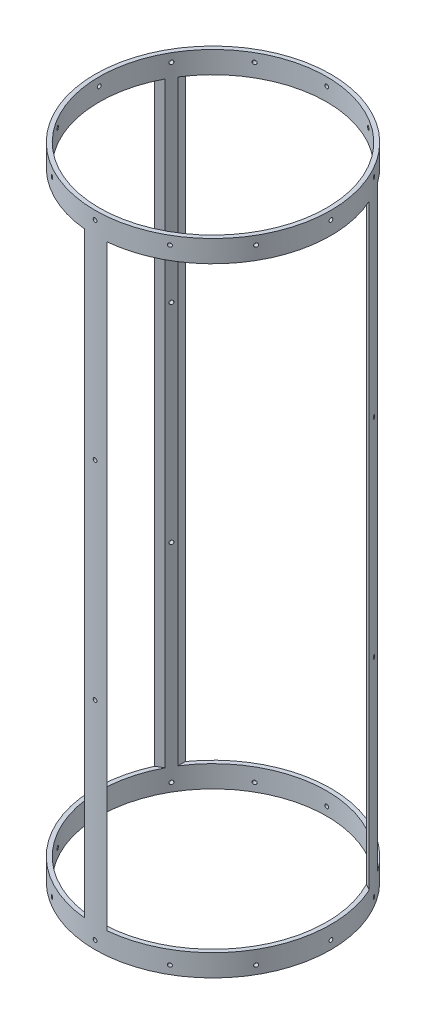
from build123d import *

# Parameters (mm, degrees)
SKETCH1_R                = 88.9
SKETCH1_R_2              = 85.725
BOSS_EXTRUDE1_DEPTH      = 241.427
CUT_EXTRUDE1_REACH       = 274.201
CUT_EXTRUDE1_END_RADIUS  = 88.9
SKETCH2_W                = 144.78
SKETCH2_H                = 449.834
CIRPATTERN1_COUNT        = 3
SKETCH4_R                = 1.4351
CUT_EXTRUDE3_DEPTH       = 15.24
CIRPATTERN3_COUNT        = 12
MIRROR1_COPY_1_SKETCH_R  = 1.4351
MIRROR1_COPY_1_DEPTH     = 15.24
MIRROR1_COPY_2_SKETCH_R  = 1.4351
MIRROR1_COPY_2_DEPTH     = 15.24
MIRROR1_COPY_3_SKETCH_R  = 1.4351
MIRROR1_COPY_3_DEPTH     = 15.24
MIRROR1_COPY_4_SKETCH_R  = 1.4351
MIRROR1_COPY_4_DEPTH     = 15.24
MIRROR1_COPY_5_SKETCH_R  = 1.4351
MIRROR1_COPY_5_DEPTH     = 15.24
MIRROR1_COPY_6_SKETCH_R  = 1.4351
MIRROR1_COPY_6_DEPTH     = 15.24
MIRROR1_COPY_7_SKETCH_R  = 1.4351
MIRROR1_COPY_7_DEPTH     = 15.24
MIRROR1_COPY_8_SKETCH_R  = 1.4351
MIRROR1_COPY_8_DEPTH     = 15.24
MIRROR1_COPY_9_SKETCH_R  = 1.4351
MIRROR1_COPY_9_DEPTH     = 15.24
MIRROR1_COPY_10_SKETCH_R = 1.4351
MIRROR1_COPY_10_DEPTH    = 15.24
MIRROR1_COPY_11_SKETCH_R = 1.4351
MIRROR1_COPY_11_DEPTH    = 15.24
SKETCH5_R                = 1.4351
CUT_EXTRUDE4_DEPTH       = 22.86
CIRPATTERN4_COUNT        = 3


with BuildPart() as part:
    # Sketch1 → Boss-Extrude1 (new, symmetric)
    with BuildSketch(Plane(origin=(0, 0, 0), x_dir=(1, 0, 0), z_dir=(0, 1, 0))):
        with Locations(Location((0, 0, 0), (0, 0, 270))):
            Circle(SKETCH1_R)
        with Locations(Location((0, 0, 0), (0, 0, 270))):
            Circle(SKETCH1_R_2, mode=Mode.SUBTRACT)
    extrude(amount=BOSS_EXTRUDE1_DEPTH, both=True)

    # Cut-Extrude1: up to this cylinder (the profile starts inside it)
    cut_extrude1_end = Plane(origin=(0, 0, 0), z_dir=(0, -1, 0)) * Cylinder(CUT_EXTRUDE1_END_RADIUS, 727.202, mode=Mode.PRIVATE)
    # Sketch2 → Cut-Extrude1 (cut, up to the surface)
    with BuildSketch(Plane.XY, mode=Mode.PRIVATE) as cut_extrude1_sk1:
        Rectangle(SKETCH2_W, SKETCH2_H)
    cut_extrude1_tool1 = extrude(cut_extrude1_sk1.sketch, amount=-CUT_EXTRUDE1_REACH, mode=Mode.PRIVATE) & cut_extrude1_end
    cut_extrude1 = cut_extrude1_tool1.solids().sort_by_distance((0, 0, 0))[0]
    add(cut_extrude1, mode=Mode.SUBTRACT)

    # CirPattern1: Cut-Extrude1 ×3 about axis
    cirpattern1_axis = Axis((0, 0, 0), (0, 1, 0))
    for i in range(1, CIRPATTERN1_COUNT):
        add(cut_extrude1.rotate(cirpattern1_axis, i * 360 / CIRPATTERN1_COUNT), mode=Mode.SUBTRACT)

    # Sketch4 → Cut-Extrude3 (cut)
    with BuildSketch(Plane(origin=(88.9, 0, 0), x_dir=(0, 0, -1), z_dir=(1, 0, 0))):
        with Locations((0, 235.077)):
            Circle(SKETCH4_R)
    cut_extrude3 = extrude(amount=-CUT_EXTRUDE3_DEPTH, mode=Mode.SUBTRACT)

    # CirPattern3: Cut-Extrude3 ×12 about axis
    cirpattern3_axis = Axis((0, 241.427, 0), (0, -1, 0))
    for i in range(1, CIRPATTERN3_COUNT):
        add(cut_extrude3.rotate(cirpattern3_axis, i * 360 / CIRPATTERN3_COUNT), mode=Mode.SUBTRACT)

    # Mirror1: Cut-Extrude3 across plane
    add(cut_extrude3.mirror(Plane.ZX), mode=Mode.SUBTRACT)

    # Mirror1 copy 1 sketch → Mirror1 copy 1 (cut)
    with BuildSketch(Plane(origin=(76.989658396, 0, 44.45), x_dir=(0.49999999999999994, 0, -0.8660254037844387), z_dir=(0.8660254037844387, 0, 0.49999999999999994))):
        with Locations((0, -235.077)):
            Circle(MIRROR1_COPY_1_SKETCH_R)
    extrude(amount=-MIRROR1_COPY_1_DEPTH, mode=Mode.SUBTRACT)

    # Mirror1 copy 2 sketch → Mirror1 copy 2 (cut)
    with BuildSketch(Plane(origin=(44.45, 0, 76.989658396), x_dir=(0.8660254037844386, 0, -0.5000000000000001), z_dir=(0.5000000000000001, 0, 0.8660254037844386))):
        with Locations((0, -235.077)):
            Circle(MIRROR1_COPY_2_SKETCH_R)
    extrude(amount=-MIRROR1_COPY_2_DEPTH, mode=Mode.SUBTRACT)

    # Mirror1 copy 3 sketch → Mirror1 copy 3 (cut)
    with BuildSketch(Plane.XY.offset(88.9)):
        with Locations((0, -235.077)):
            Circle(MIRROR1_COPY_3_SKETCH_R)
    extrude(amount=-MIRROR1_COPY_3_DEPTH, mode=Mode.SUBTRACT)

    # Mirror1 copy 4 sketch → Mirror1 copy 4 (cut)
    with BuildSketch(Plane(origin=(-44.45, 0, 76.989658396), x_dir=(0.8660254037844387, 0, 0.4999999999999998), z_dir=(-0.4999999999999998, 0, 0.8660254037844387))):
        with Locations((0, -235.077)):
            Circle(MIRROR1_COPY_4_SKETCH_R)
    extrude(amount=-MIRROR1_COPY_4_DEPTH, mode=Mode.SUBTRACT)

    # Mirror1 copy 5 sketch → Mirror1 copy 5 (cut)
    with BuildSketch(Plane(origin=(-76.989658396, 0, 44.45), x_dir=(0.49999999999999994, 0, 0.8660254037844387), z_dir=(-0.8660254037844387, 0, 0.49999999999999994))):
        with Locations((0, -235.077)):
            Circle(MIRROR1_COPY_5_SKETCH_R)
    extrude(amount=-MIRROR1_COPY_5_DEPTH, mode=Mode.SUBTRACT)

    # Mirror1 copy 6 sketch → Mirror1 copy 6 (cut)
    with BuildSketch(Plane.ZY.offset(88.9)):
        with Locations((0, -235.077)):
            Circle(MIRROR1_COPY_6_SKETCH_R)
    extrude(amount=-MIRROR1_COPY_6_DEPTH, mode=Mode.SUBTRACT)

    # Mirror1 copy 7 sketch → Mirror1 copy 7 (cut)
    with BuildSketch(Plane(origin=(-76.989658396, 0, -44.45), x_dir=(-0.5000000000000001, 0, 0.8660254037844386), z_dir=(-0.8660254037844386, 0, -0.5000000000000001))):
        with Locations((0, -235.077)):
            Circle(MIRROR1_COPY_7_SKETCH_R)
    extrude(amount=-MIRROR1_COPY_7_DEPTH, mode=Mode.SUBTRACT)

    # Mirror1 copy 8 sketch → Mirror1 copy 8 (cut)
    with BuildSketch(Plane(origin=(-44.45, 0, -76.989658396), x_dir=(-0.8660254037844384, 0, 0.5000000000000004), z_dir=(-0.5000000000000004, 0, -0.8660254037844384))):
        with Locations((0, -235.077)):
            Circle(MIRROR1_COPY_8_SKETCH_R)
    extrude(amount=-MIRROR1_COPY_8_DEPTH, mode=Mode.SUBTRACT)

    # Mirror1 copy 9 sketch → Mirror1 copy 9 (cut)
    with BuildSketch(Plane(origin=(0, 0, -88.9), x_dir=(-1, 0, 0), z_dir=(0, 0, -1))):
        with Locations((0, -235.077)):
            Circle(MIRROR1_COPY_9_SKETCH_R)
    extrude(amount=-MIRROR1_COPY_9_DEPTH, mode=Mode.SUBTRACT)

    # Mirror1 copy 10 sketch → Mirror1 copy 10 (cut)
    with BuildSketch(Plane(origin=(44.45, 0, -76.989658396), x_dir=(-0.8660254037844386, 0, -0.5000000000000001), z_dir=(0.5000000000000001, 0, -0.8660254037844386))):
        with Locations((0, -235.077)):
            Circle(MIRROR1_COPY_10_SKETCH_R)
    extrude(amount=-MIRROR1_COPY_10_DEPTH, mode=Mode.SUBTRACT)

    # Mirror1 copy 11 sketch → Mirror1 copy 11 (cut)
    with BuildSketch(Plane(origin=(76.989658396, 0, -44.45), x_dir=(-0.5000000000000004, 0, -0.8660254037844384), z_dir=(0.8660254037844384, 0, -0.5000000000000004))):
        with Locations((0, -235.077)):
            Circle(MIRROR1_COPY_11_SKETCH_R)
    extrude(amount=-MIRROR1_COPY_11_DEPTH, mode=Mode.SUBTRACT)

    # Sketch5 → Cut-Extrude4 (cut)
    with BuildSketch(Plane.XY.offset(88.9)):
        with Locations((0, 78.359)):
            Circle(SKETCH5_R)
        with Locations((0, -78.359)):
            Circle(SKETCH5_R)
    cut_extrude4 = extrude(amount=-CUT_EXTRUDE4_DEPTH, mode=Mode.SUBTRACT)

    # CirPattern4: Cut-Extrude4 ×3 about axis
    cirpattern4_axis = Axis((0, 241.427, 0), (0, -1, 0))
    for i in range(1, CIRPATTERN4_COUNT):
        add(cut_extrude4.rotate(cirpattern4_axis, i * 360 / CIRPATTERN4_COUNT), mode=Mode.SUBTRACT)


solid = part.part
